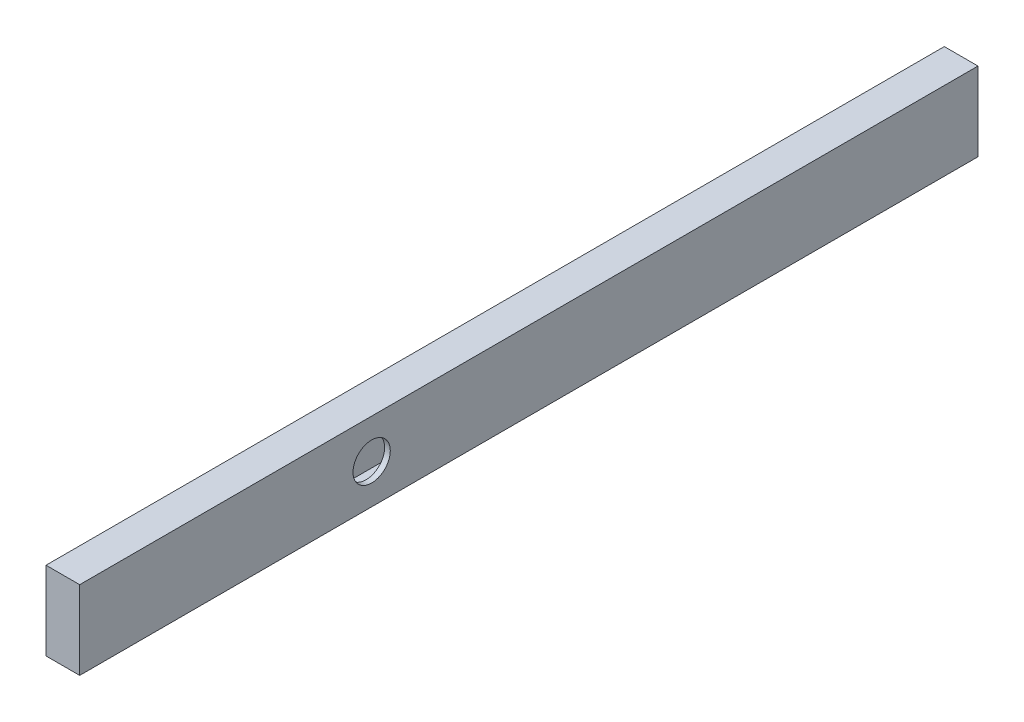
from build123d import *

# Parameters (mm, degrees)
SKETCH1_W                    = 88.9
SKETCH1_H                    = 38.1
BOSS_EXTRUDE1_DEPTH          = 1016
SHELL1_T                     = -6.35
F_5_16_1_66_DIAMETER_HOLE1_D = 42.164


with BuildPart() as part:
    # Sketch1 → Boss-Extrude1 (new body)
    with BuildSketch(Plane(origin=(0, 0, 0), x_dir=(0, 1, 0), z_dir=(0, 0, 1))):
        Rectangle(SKETCH1_W, SKETCH1_H)
    extrude(amount=BOSS_EXTRUDE1_DEPTH)

    # Shell1
    shell1_openings = [part.faces().sort_by_distance(p)[0] for p in [
        (0, 0, 0),
    ]]
    offset(amount=SHELL1_T, openings=shell1_openings, kind=Kind.INTERSECTION)

    # 5/16 (1.66) Diameter Hole1 (through all)
    with Locations(Plane.YZ.offset(19.05)):
        with Locations((0, 685.8)):
            Hole(F_5_16_1_66_DIAMETER_HOLE1_D / 2)


solid = part.part
